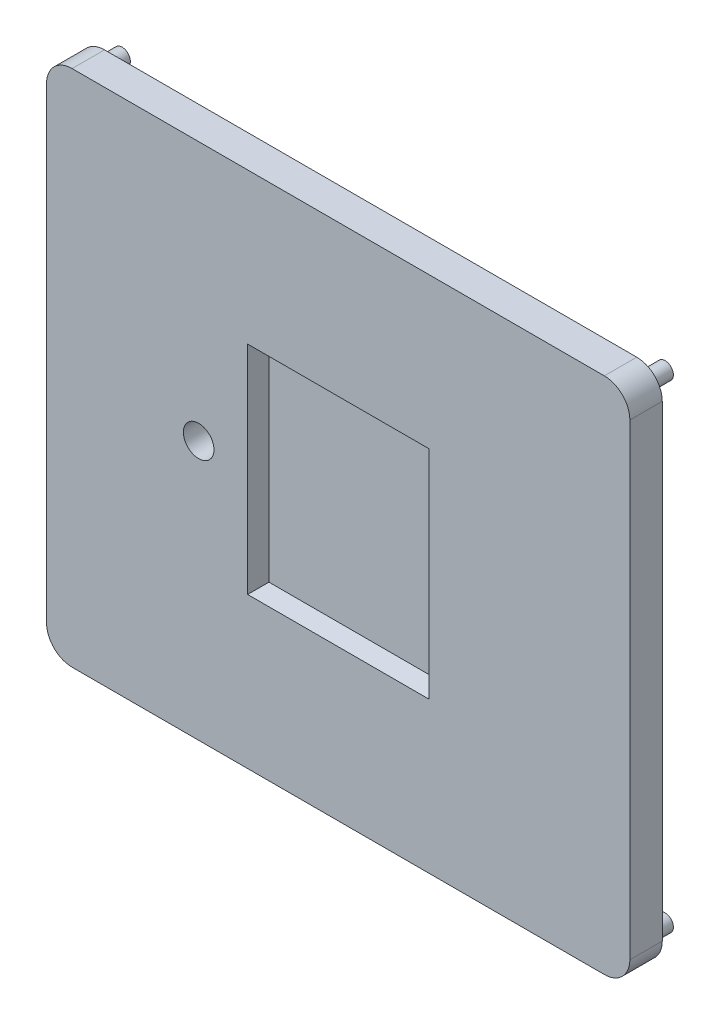
from build123d import *

# Parameters (mm, degrees)
LID_DEPTH           = 12.7
SKETCH2_R           = 3.25
CORNER_SHAFTS_DEPTH = 9
SKETCH9_R           = 6
WIRE_HOLE_DEPTH     = 201.174580316


with BuildPart() as part:
    # Sketch1 → Lid (new body)
    with BuildSketch(Plane(origin=(-2.566079358, -10, 0), x_dir=(1, 0, 0), z_dir=(0, 0, 1))):
        with BuildLine():
            Line((-145.603603604, 92.446846847), (62.996396396, 92.446846847))
            ThreePointArc((62.996396396, 92.446846847), (70.067464208, 89.517914659), (72.996396396, 82.446846847))
            Line((72.996396396, 82.446846847), (72.996396396, -100.753153153))
            ThreePointArc((72.996396396, -100.753153153), (70.067464208, -107.824220965), (62.996396396, -110.753153153))
            Line((62.996396396, -110.753153153), (-145.603603604, -110.753153153))
            ThreePointArc((-145.603603604, -110.753153153), (-152.674671415, -107.824220965), (-155.603603604, -100.753153153))
            Line((-155.603603604, -100.753153153), (-155.603603604, 82.446846847))
            ThreePointArc((-155.603603604, 82.446846847), (-152.674671415, 89.517914659), (-145.603603604, 92.446846847))
        make_face()
    extrude(amount=LID_DEPTH)

    # Sketch2 → Corner Shafts (add)
    with BuildSketch(Plane.XY):
        with BuildLine():
            Line((60.253540343, -110.576376458), (64.849734421, -115.172570536))
            ThreePointArc((64.849734421, -115.172570536), (64.849734421, -110.576376458), (60.253540343, -110.576376458))
        make_face()
        with Locations((-150.291003305, -112.874473497)):
            Circle(SKETCH2_R)
        with Locations((-150.291003305, 74.56816719)):
            Circle(SKETCH2_R)
        with Locations((62.551637382, 74.56816719)):
            Circle(SKETCH2_R)
    extrude(amount=-CORNER_SHAFTS_DEPTH)

    # Sketch8 → Kinect Loft Cut section 0
    with BuildSketch(Plane.XY.offset(12.7)):
        with BuildLine():
            Line((-8.369682962, 23.346846847), (-79.369682962, 23.346846847))
            Line((-79.369682962, 23.346846847), (-79.369682962, -61.653153153))
            Line((-79.369682962, -61.653153153), (-8.369682962, -61.653153153))
            Line((-8.369682962, -61.653153153), (-8.369682962, 23.346846847))
        make_face()
    # Base for Kinect → Kinect Loft Cut section 1
    with BuildSketch(Plane.XY.offset(6.35)):
        with BuildLine():
            Line((-10.369682962, 21.346846847), (-77.369682962, 21.346846847))
            Line((-77.369682962, 21.346846847), (-77.369682962, -59.653153153))
            Line((-77.369682962, -59.653153153), (-10.369682962, -59.653153153))
            Line((-10.369682962, -59.653153153), (-10.369682962, 21.346846847))
        make_face()
    loft(mode=Mode.SUBTRACT)

    # Sketch9 → Wire Hole (cut, through all)
    with BuildSketch(Plane.XY.offset(12.7)):
        with Locations((-98.566640815, -19.153153153)):
            Circle(SKETCH9_R)
    extrude(amount=-WIRE_HOLE_DEPTH, mode=Mode.SUBTRACT)


solid = part.part
